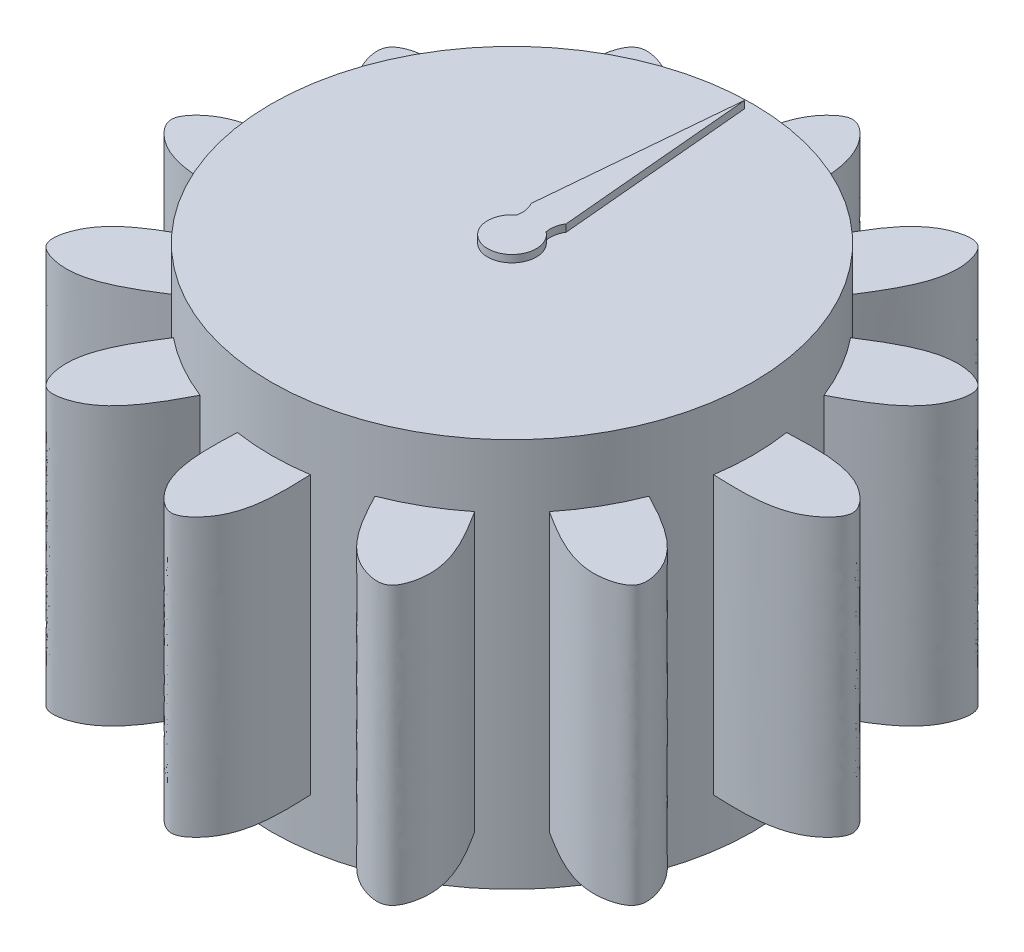
from build123d import *

# Parameters (mm, degrees)
SKETCH1_R           = 9.9
BOSS_EXTRUDE1_DEPTH = 12
SKETCH2_R           = 9.9
BOSS_EXTRUDE2_DEPTH = 2
BOSS_EXTRUDE3_DEPTH = 0.3
BOSS_EXTRUDE5_DEPTH = 11.4
CIRPATTERN1_COUNT   = 12
BOSS_EXTRUDE6_START = 2
SKETCH5_R           = 9.9
BOSS_EXTRUDE6_DEPTH = 2
BOSS_EXTRUDE7_START = 0.3
BOSS_EXTRUDE7_DEPTH = 0.3


with BuildPart() as part:
    # Sketch1 → Boss-Extrude1 (new body)
    with BuildSketch(Plane(origin=(0, 0, 0), x_dir=(1, 0, 0), z_dir=(0, 1, 0))):
        with Locations(Location((0, 0, 0), (0, 0, 270))):
            Circle(SKETCH1_R)
    extrude(amount=BOSS_EXTRUDE1_DEPTH)

    # Sketch2 → Boss-Extrude2 (add)
    with BuildSketch(Plane(origin=(0, 12, 0), x_dir=(1, 0, 0), z_dir=(0, 1, 0))):
        with Locations(Location((0, 0, 0), (0, 0, 270))):
            Circle(SKETCH2_R)
    extrude(amount=BOSS_EXTRUDE2_DEPTH)

    # Sketch3 → Boss-Extrude3 (add)
    with BuildSketch(Plane(origin=(0, 14, 0), x_dir=(1, 0, 0), z_dir=(0, 1, 0))):
        with BuildLine():
            Line((0, 9.561873975), (0.727858815, 1.5))
            ThreePointArc((0.727858815, 1.5), (0.597494474, 1.162134703), (0.6, 0.8))
            ThreePointArc((0.6, 0.8), (0, -1), (-0.6, 0.8))
            ThreePointArc((-0.6, 0.8), (-0.592381481, 1.161228328), (-0.71735976, 1.500233309))
            Line((-0.71735976, 1.500233309), (0, 9.561873975))
        make_face()
    extrude(amount=BOSS_EXTRUDE3_DEPTH)

    # Sketch4 → Boss-Extrude5 (add)
    with BuildSketch(Plane.XZ):
        with BuildLine():
            Line((-1.5, -9.785703858), (1.5, -9.785703858))
            add(Edge.make_bspline(
                [(1.5, -9.785703858), (1.52233311, -10.350909106), (1.574363817, -11.667699624), (1.199302648, -13.281179815), (0, -14.188968688), (-1.199302648, -13.281179815), (-1.574363817, -11.667699624), (-1.52233311, -10.350909106), (-1.5, -9.785703858)],
                knots=[0, 0, 0, 0, 0.178316257, 0.415433434, 0.5, 0.584566566, 0.821683743, 1, 1, 1, 1], degree=3))
        make_face()
    boss_extrude5 = extrude(amount=-BOSS_EXTRUDE5_DEPTH)

    # CirPattern1: Boss-Extrude5 ×12 about axis
    cirpattern1_axis = Axis((0, 0, 0), (0, 1, 0))
    for i in range(1, CIRPATTERN1_COUNT):
        add(boss_extrude5.rotate(cirpattern1_axis, i * 360 / CIRPATTERN1_COUNT))

    # Sketch5 → Boss-Extrude6 (add)
    with BuildSketch(Plane.XZ.offset(BOSS_EXTRUDE6_START)):
        with Locations(Location((0, 0, 0), (0, 0, 270))):
            Circle(SKETCH5_R)
    extrude(amount=-BOSS_EXTRUDE6_DEPTH)

    # Sketch6 → Boss-Extrude7 (add)
    with BuildSketch(Plane.XZ.offset(2).offset(BOSS_EXTRUDE7_START)):
        with BuildLine():
            Line((0, -9.561873975), (0.727858815, -1.5))
            ThreePointArc((0.727858815, -1.5), (0.597494474, -1.162134703), (0.6, -0.8))
            ThreePointArc((0.6, -0.8), (0, 1), (-0.6, -0.8))
            ThreePointArc((-0.6, -0.8), (-0.592381481, -1.161228328), (-0.71735976, -1.500233309))
            Line((-0.71735976, -1.500233309), (0, -9.561873975))
        make_face()
    extrude(amount=-BOSS_EXTRUDE7_DEPTH)


solid = part.part
